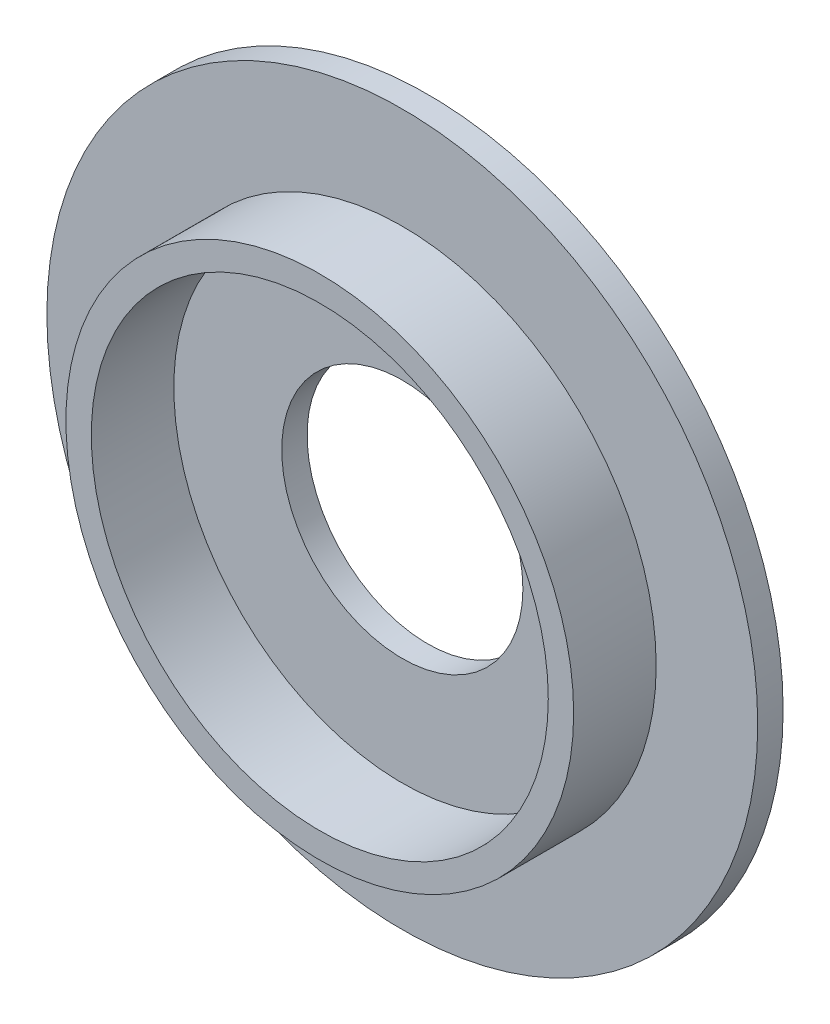
from build123d import *

# Parameters (mm, degrees)
SKETCH_1_R      = 140
SKETCH_1_R_2    = 47.5
EXTRUDE_1_DEPTH = 10
SKETCH_2_R      = 100
SKETCH_2_R_2    = 90
EXTRUDE_2_DEPTH = 32.5


with BuildPart() as part:
    # 草图1 → 拉伸1 (new body)
    with BuildSketch(Plane.XY):
        Circle(SKETCH_1_R)
        Circle(SKETCH_1_R_2, mode=Mode.SUBTRACT)
    extrude(amount=EXTRUDE_1_DEPTH)

    # 草图2 → 拉伸2 (add)
    with BuildSketch(Plane.XY.offset(10)):
        Circle(SKETCH_2_R)
        Circle(SKETCH_2_R_2, mode=Mode.SUBTRACT)
    extrude(amount=EXTRUDE_2_DEPTH)


solid = part.part
